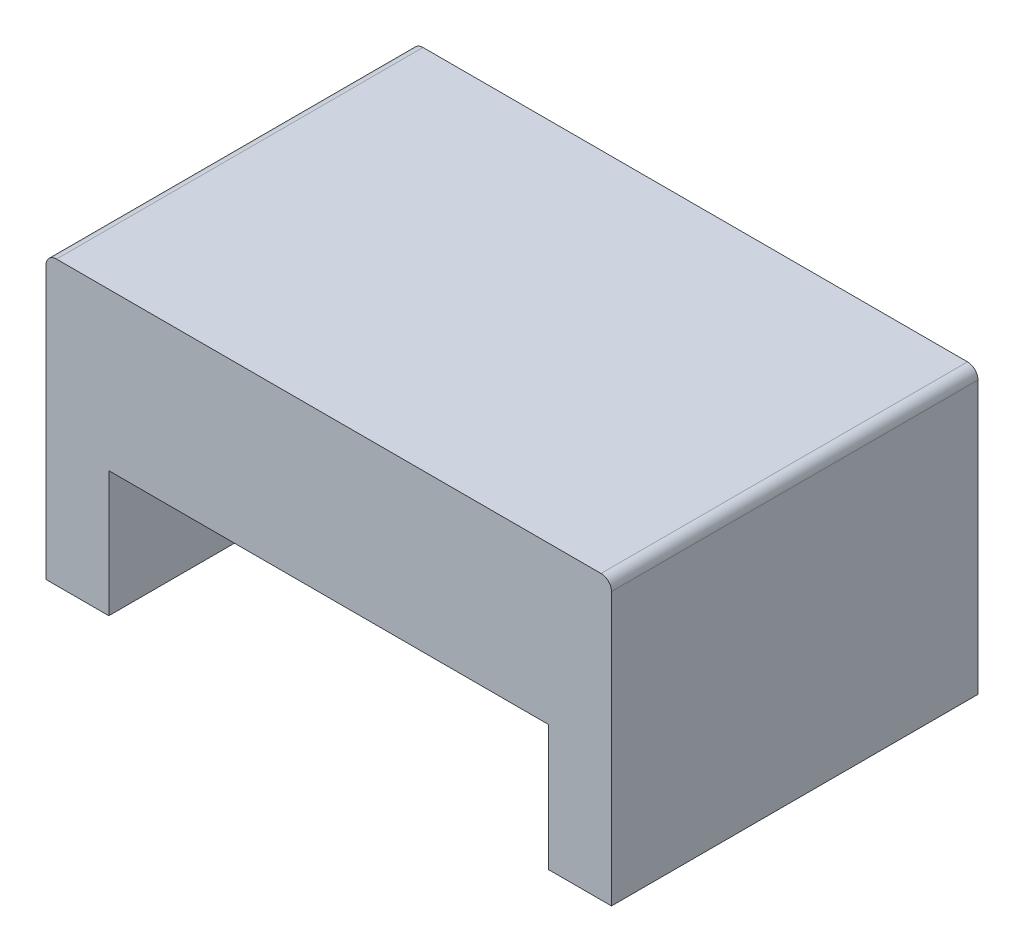
from build123d import *

# Parameters (mm, degrees)
BOSS_EXTRUDE1_DEPTH = 35
FILLET1_R           = 1


with BuildPart() as part:
    # Sketch1 → Boss-Extrude1 (new body)
    with BuildSketch(Plane.XY):
        Polygon((-25.340782123, -16.881284916), (-25.340782123, -4.881284916), (16.659217877, -4.881284916), (16.659217877, -16.881284916), (22.659217877, -16.881284916), (22.659217877, 10.118715084), (-31.340782123, 10.118715084), (-31.340782123, -16.881284916), align=None)
    extrude(amount=BOSS_EXTRUDE1_DEPTH)

    # Fillet1
    fillet1_edges = [part.edges().sort_by_distance(p)[0] for p in [
        (-31.340782123, 10.118715084, 17.5),
        (22.659217877, 10.118715084, 17.5),
    ]]
    fillet(fillet1_edges, radius=FILLET1_R)


solid = part.part
